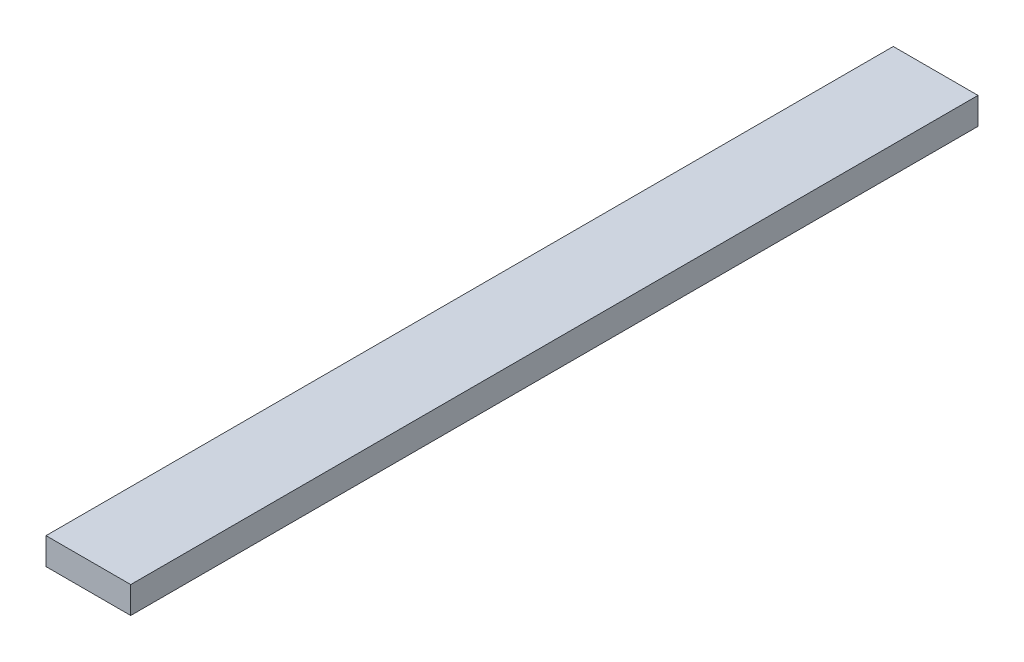
from build123d import *

# Parameters (mm, degrees)
SKETCH1_W           = 60
SKETCH1_H           = 19
BOSS_EXTRUDE1_DEPTH = 600
SKETCH2_R           = 2.5
CUT_EXTRUDE1_DEPTH  = 10


with BuildPart() as part:
    # Sketch1 → Boss-Extrude1 (new body)
    with BuildSketch(Plane.XY):
        with Locations((30, 9.5)):
            Rectangle(SKETCH1_W, SKETCH1_H)
    extrude(amount=BOSS_EXTRUDE1_DEPTH)

    # Sketch2 → Cut-Extrude1 (cut)
    with BuildSketch(Plane(origin=(0, 0, 0), x_dir=(-1, 0, 0), z_dir=(0, -1, 0))):
        with Locations(Location((-38, -8, 0), (0, 0, 90))):
            Circle(SKETCH2_R)
        with Locations(Location((-38, -592, 0), (0, 0, 90))):
            Circle(SKETCH2_R)
    extrude(amount=-CUT_EXTRUDE1_DEPTH, mode=Mode.SUBTRACT)


solid = part.part
